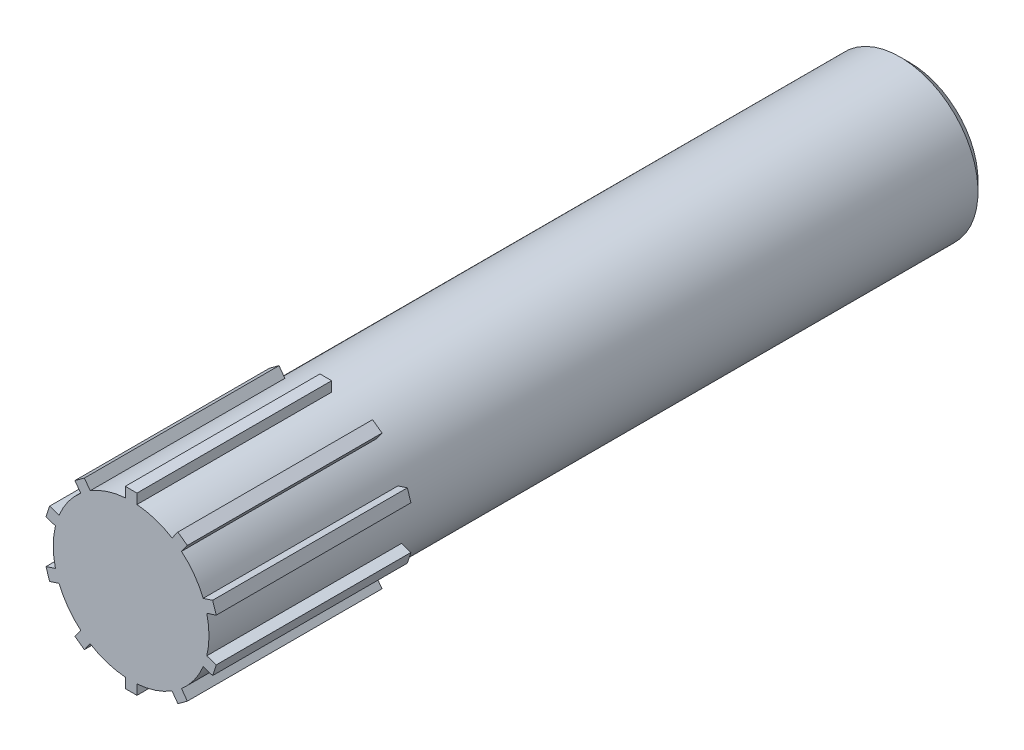
from build123d import *

# Parameters (mm, degrees)
SKETCH2_R           = 4
BOSS_EXTRUDE1_DEPTH = 40
CUT_EXTRUDE3_START  = -2.5
CUT_EXTRUDE3_DEPTH  = 38.898019753
CHAMFER1_SIZE       = 0.5
SKETCH4_W           = 0.6
SKETCH4_H           = 1
BOSS_EXTRUDE2_DEPTH = 10
CIRPATTERN1_COUNT   = 10


with BuildPart() as part:
    # Sketch2 → Boss-Extrude1 (new body)
    with BuildSketch(Plane.XY):
        Circle(SKETCH2_R)
    extrude(amount=BOSS_EXTRUDE1_DEPTH)

    # Sketch3 → Cut-Extrude3 (cut, through all)
    with BuildSketch(Plane(origin=(0, 0, 0), x_dir=(1, 0, 0), z_dir=(0, 1, 0)).offset(CUT_EXTRUDE3_START)):
        with BuildLine():
            Line((1.5, 0), (1.5, -4))
            ThreePointArc((1.5, -4), (0, -5.5), (-1.5, -4))
            Line((-1.5, -4), (-1.5, 0))
            ThreePointArc((-1.5, 0), (0, 1.5), (1.5, 0))
        make_face()
    extrude(amount=-CUT_EXTRUDE3_DEPTH, mode=Mode.SUBTRACT)

    # Chamfer1
    chamfer1_edges = [part.edges().sort_by_distance(p)[0] for p in [
        (-2.236067977, 3.31662479, 0),
    ]]
    chamfer(chamfer1_edges, length=CHAMFER1_SIZE)

    # Sketch4 → Boss-Extrude2 (add)
    with BuildSketch(Plane.XY.offset(40)):
        with Locations((0, 4)):
            Rectangle(SKETCH4_W, SKETCH4_H)
    boss_extrude2 = extrude(amount=-BOSS_EXTRUDE2_DEPTH)

    # CirPattern1: Boss-Extrude2 ×10 about axis
    cirpattern1_axis = Axis((0, 0, 0), (0, 0, 1))
    for i in range(1, CIRPATTERN1_COUNT):
        add(boss_extrude2.rotate(cirpattern1_axis, i * 360 / CIRPATTERN1_COUNT))


solid = part.part
